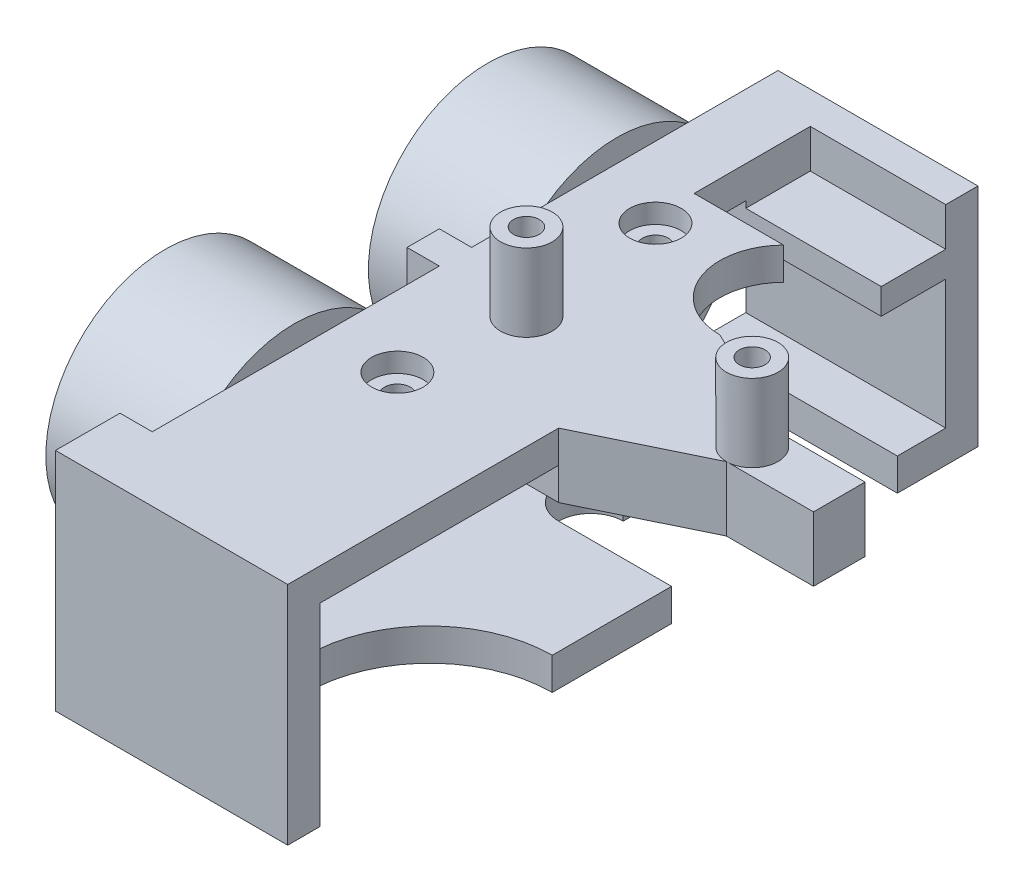
from build123d import *

# Parameters (mm, degrees)
SKETCH_1_W               = 62
SKETCH_1_H               = 90
SKETCH_1_R               = 5
SKETCH_1_R_2             = 10
EXTRUDE_1_DEPTH          = 7
SKETCH_3_R               = 10
SKETCH_3_R_2             = 5
EXTRUDE_2_DEPTH          = 7
SKETCH_4_R               = 18.5
EXTRUDE_3_DEPTH          = 20
SKETCH_5_W               = 42
SKETCH_5_H               = 18
CUT_EXTRUDE_1_DEPTH      = 7
SKETCH_7_R               = 2
EXTRUDE_5_DEPTH          = 5
SKETCH_6_R               = 4
SKETCH_6_R_2             = 2
EXTRUDE_7_DEPTH          = 12
SKETCH_18_R              = 4
CUT_EXTRUDE_8_DEPTH      = 3
CUT_EXTRUDE_3_DEPTH      = 73.124891681
CUT_EXTRUDE_3_DEPTH_BACK = 73.124891681
SKETCH_10_W              = 13.858571571
SKETCH_10_H              = 11.898979486
SKETCH_10_W_2            = 20
SKETCH_10_H_2            = 30
CUT_EXTRUDE_4_DEPTH      = 7
SKETCH_11_W              = 17.5
SKETCH_11_H              = 10
CUT_EXTRUDE_5_DEPTH      = 7
CUT_EXTRUDE_9_REACH      = 84.674
SKETCH_19_W              = 10.885621722
SKETCH_19_H              = 15
SKETCH_12_W              = 92.977348864
SKETCH_12_H              = 90
CUT_EXTRUDE_6_DEPTH      = 2
SKETCH_13_W              = 67.267412259
SKETCH_13_H              = 90
CUT_EXTRUDE_7_DEPTH      = 2
SKETCH_14_W              = 31
SKETCH_14_H              = 35
EXTRUDE_8_DEPTH          = 5
SKETCH_15_W              = 14.844505579
SKETCH_15_H              = 5
EXTRUDE_9_DEPTH          = 7
SKETCH_16_W              = 31
SKETCH_16_H              = 35
EXTRUDE_10_DEPTH         = 5
SKETCH_20_W              = 21
SKETCH_20_H              = 10
EXTRUDE_11_DEPTH         = 4
SKETCH_21_W              = 5
SKETCH_21_H              = 35
SKETCH_21_W_2            = 10
EXTRUDE_12_DEPTH         = 5
SKETCH_22_R              = 10
CUT_EXTRUDE_10_DEPTH     = 103.708324882
SKETCH_23_W              = 20
SKETCH_23_H              = 10
CUT_EXTRUDE_11_DEPTH     = 11


with BuildPart() as part:
    # 草图1 → 凸台-拉伸1 (new body)
    with BuildSketch(Plane(origin=(0, 0, 0), x_dir=(1, 0, 0), z_dir=(0, 1, 0))):
        Rectangle(SKETCH_1_W, SKETCH_1_H)
        with Locations(Location((-20, 20, 0), (0, 0, 270))):
            Circle(SKETCH_1_R, mode=Mode.SUBTRACT)
        with Locations(Location((20, 20, 0), (0, 0, 270))):
            Circle(SKETCH_1_R, mode=Mode.SUBTRACT)
        with Locations(Location((20, -20, 0), (0, 0, 270))):
            Circle(SKETCH_1_R, mode=Mode.SUBTRACT)
        with Locations(Location((-20, -20, 0), (0, 0, 270))):
            Circle(SKETCH_1_R, mode=Mode.SUBTRACT)
        with Locations(Location((0, 20, 0), (0, 0, 270))):
            Circle(SKETCH_1_R_2, mode=Mode.SUBTRACT)
    extrude(amount=EXTRUDE_1_DEPTH)



with BuildPart() as body_2:
    # 草图3 → 凸台-拉伸2 (new body)
    with BuildSketch(Plane(origin=(0, -16, 0), x_dir=(-1, 0, 0), z_dir=(0, -1, 0))):
        with BuildLine():
            Line((-31, 45), (31, 45))
            Line((31, 45), (31, -45))
            Line((31, -45), (16.155494421, -45))
            ThreePointArc((16.155494421, -45), (0, -16), (-16.155494421, -45))
            Line((-16.155494421, -45), (-31, -45))
            Line((-31, -45), (-31, 45))
        make_face()
        with Locations(Location((0, 20, 0), (0, 0, 270))):
            Circle(SKETCH_3_R, mode=Mode.SUBTRACT)
        with Locations(Location((17.5, 32.5, 0), (0, 0, 90))):
            Circle(SKETCH_3_R_2, mode=Mode.SUBTRACT)
        with Locations(Location((17.5, 7.5, 0), (0, 0, 90))):
            Circle(SKETCH_3_R_2, mode=Mode.SUBTRACT)
        with Locations(Location((-17.5, 7.5, 0), (0, 0, 90))):
            Circle(SKETCH_3_R_2, mode=Mode.SUBTRACT)
        with Locations(Location((-17.5, 32.5, 0), (0, 0, 90))):
            Circle(SKETCH_3_R_2, mode=Mode.SUBTRACT)
    extrude(amount=EXTRUDE_2_DEPTH)


with BuildPart() as part_1:
    add(part.part)

    add(body_2.part)  # 凸台-拉伸3 merges body 2
    # 草图4 → 凸台-拉伸3 (add)
    with BuildSketch(Plane(origin=(31, 0, 0), x_dir=(0, 0, -1), z_dir=(1, 0, 0))):
        with Locations(Location((-25, -3, 0), (0, 0, 170.667581816))):
            Circle(SKETCH_4_R)
        with Locations(Location((25, -3, 0), (0, 0, 170.667581816))):
            Circle(SKETCH_4_R)
    extrude_3 = extrude(amount=EXTRUDE_3_DEPTH)

    # 镜向1: 凸台-拉伸3 across plane
    add(extrude_3.mirror(Plane(origin=(0, 0, 0), x_dir=(0, 0, 1), z_dir=(1, 0, 0))))

    # 草图5 → 切除-拉伸1 (cut)
    with BuildSketch(Plane(origin=(0, 7, 0), x_dir=(1, 0, 0), z_dir=(0, 1, 0))):
        with Locations((0, 36)):
            Rectangle(SKETCH_5_W, SKETCH_5_H)
    extrude(amount=-CUT_EXTRUDE_1_DEPTH, mode=Mode.SUBTRACT)

    # 草图7 → 凸台-拉伸5 (add)
    with BuildSketch(Plane(origin=(0, 7, 0), x_dir=(1, 0, 0), z_dir=(0, 1, 0))):
        with BuildLine():
            Line((-7.141428429, 27), (-21, 27))
            Line((-21, 27), (-21, 45))
            Line((-21, 45), (-31, 45))
            Line((-31, 45), (-31, -45))
            Line((-31, -45), (31, -45))
            Line((31, -45), (31, 45))
            Line((31, 45), (21, 45))
            Line((21, 45), (21, 27))
            Line((21, 27), (7.141428429, 27))
            ThreePointArc((7.141428429, 27), (0, 10), (-7.141428429, 27))
        make_face()
        with Locations(Location((-20, 20, 0), (0, 0, 270))):
            Circle(SKETCH_7_R, mode=Mode.SUBTRACT)
        with Locations(Location((20, 20, 0), (0, 0, 270))):
            Circle(SKETCH_7_R, mode=Mode.SUBTRACT)
        with Locations(Location((20, -20, 0), (0, 0, 270))):
            Circle(SKETCH_7_R, mode=Mode.SUBTRACT)
        with Locations(Location((-20, -20, 0), (0, 0, 270))):
            Circle(SKETCH_7_R, mode=Mode.SUBTRACT)
    extrude(amount=EXTRUDE_5_DEPTH)

    # 草图6 → 凸台-拉伸7 (add)
    # profile 1 of 2: a face of its own
    with BuildSketch(Plane(origin=(0, 12, 0), x_dir=(1, 0, 0), z_dir=(0, 1, 0))):
        with Locations(Location((-17.5, -2.5, 0), (0, 0, 270))):
            Circle(SKETCH_6_R)
        with Locations(Location((-17.5, -2.5, 0), (0, 0, 270))):
            Circle(SKETCH_6_R_2, mode=Mode.SUBTRACT)
    # profile 2 of 2: a face of its own
    with BuildSketch(Plane(origin=(0, 12, 0), x_dir=(1, 0, 0), z_dir=(0, 1, 0))):
        with Locations(Location((17.5, -2.5, 0), (0, 0, 90))):
            Circle(SKETCH_6_R)
        with Locations(Location((17.5, -2.5, 0), (0, 0, 90))):
            Circle(SKETCH_6_R_2, mode=Mode.SUBTRACT)
    extrude(amount=EXTRUDE_7_DEPTH)

    # 草图18 → 切除-拉伸8 (cut)
    with BuildSketch(Plane(origin=(0, 12, 0), x_dir=(1, 0, 0), z_dir=(0, 1, 0))):
        with Locations(Location((-20, 20, 0), (0, 0, 270))):
            Circle(SKETCH_18_R)
        with Locations(Location((20, 20, 0), (0, 0, 270))):
            Circle(SKETCH_18_R)
        with Locations(Location((20, -20, 0), (0, 0, 270))):
            Circle(SKETCH_18_R)
        with Locations(Location((-20, -20, 0), (0, 0, 270))):
            Circle(SKETCH_18_R)
    extrude(amount=-CUT_EXTRUDE_8_DEPTH, mode=Mode.SUBTRACT)

    # 草图9 → 切除-拉伸3 (cut, two sides: drawn at the far end of the back side and taken through both)
    with BuildSketch(Plane(origin=(0, 0, 0), x_dir=(1, 0, 0), z_dir=(0, 1, 0)).offset(-CUT_EXTRUDE_3_DEPTH_BACK)):
        Polygon((58.168962293, 1.5), (58.168962293, 54.540507165), (0, 54.540507165), (0, 10), (17.5, 1.5), align=None)
        Polygon((0, -53.302122896), (58.168962293, -53.302122896), (58.168962293, -6.5), (17.5, -6.5), (0, -15), align=None)
    extrude(amount=CUT_EXTRUDE_3_DEPTH + CUT_EXTRUDE_3_DEPTH_BACK, mode=Mode.SUBTRACT)

    # 草图10 → 切除-拉伸4 (cut)
    with BuildSketch(Plane(origin=(0, 0, 0), x_dir=(1, 0, 0), z_dir=(0, 1, 0))):
        with Locations((-14.070714215, 21.050510257)):
            Rectangle(SKETCH_10_W, SKETCH_10_H)
        with Locations((-10, -30)):
            Rectangle(SKETCH_10_W_2, SKETCH_10_H_2)
    extrude(amount=CUT_EXTRUDE_4_DEPTH, mode=Mode.SUBTRACT)

    # 草图11 → 切除-拉伸5 (cut)
    with BuildSketch(Plane(origin=(0, -16, 0), x_dir=(1, 0, 0), z_dir=(0, 1, 0))):
        with Locations((-8.75, 32.5)):
            Rectangle(SKETCH_11_W, SKETCH_11_H)
        Polygon((-17.5, 12.5), (32.655458142, 12.5), (32.655458142, -18.188768946), (0, -18.188768946), (0, 2.5), (-17.5, 2.5), align=None)
    extrude(amount=-CUT_EXTRUDE_5_DEPTH, mode=Mode.SUBTRACT)

    # 草图19 → 切除-拉伸9 (cut, up to next)
    with BuildSketch(Plane.XZ.offset(23), mode=Mode.PRIVATE) as cut_extrude_9_sk1:
        with Locations((-12.057189139, -20)):
            Rectangle(SKETCH_19_W, SKETCH_19_H)
    cut_extrude_9_tool1 = extrude(cut_extrude_9_sk1.sketch, amount=-CUT_EXTRUDE_9_REACH, mode=Mode.PRIVATE) & part_1.part
    add(cut_extrude_9_tool1.solids().sort_by_distance((-12.057189, -23, -20))[0], mode=Mode.SUBTRACT)

    # 草图12 → 切除-拉伸6 (cut)
    with BuildSketch(Plane.XZ):
        with Locations((15.488674432, 0)):
            Rectangle(SKETCH_12_W, SKETCH_12_H)
    extrude(amount=-CUT_EXTRUDE_6_DEPTH, mode=Mode.SUBTRACT)

    # 草图13 → 切除-拉伸7 (cut)
    with BuildSketch(Plane(origin=(0, -16, 0), x_dir=(1, 0, 0), z_dir=(0, 1, 0))):
        with Locations((2.63370613, 0)):
            Rectangle(SKETCH_13_W, SKETCH_13_H)
    extrude(amount=-CUT_EXTRUDE_7_DEPTH, mode=Mode.SUBTRACT)

    # 草图14 → 凸台-拉伸8 (add)
    with BuildSketch(Plane(origin=(0, 0, -45), x_dir=(-1, 0, 0), z_dir=(0, 0, -1))):
        with Locations((15.5, -5.5)):
            Rectangle(SKETCH_14_W, SKETCH_14_H)
    extrude(amount=EXTRUDE_8_DEPTH)

    # 草图15 → 凸台-拉伸9 (add)
    with BuildSketch(Plane.XY.offset(45)):
        Polygon((0, 12), (0, 7), (-20, 7), (-20, 2), (-31, 2), (-31, 12), align=None)
        with Locations((-23.577747211, -20.5)):
            Rectangle(SKETCH_15_W, SKETCH_15_H)
    extrude(amount=EXTRUDE_9_DEPTH)

    # 草图16 → 凸台-拉伸10 (add)
    with BuildSketch(Plane.XY.offset(52)):
        with Locations((-15.5, -5.5)):
            Rectangle(SKETCH_16_W, SKETCH_16_H)
    extrude(amount=EXTRUDE_10_DEPTH)

    # 草图20 → 凸台-拉伸11 (add)
    with BuildSketch(Plane.XZ.offset(-2)):
        with Locations((-10.5, -40)):
            Rectangle(SKETCH_20_W, SKETCH_20_H)
    extrude(amount=-EXTRUDE_11_DEPTH)

    # 草图21 → 凸台-拉伸12 (add)
    with BuildSketch(Plane.ZY.offset(31)):
        with Locations((0, -5.5)):
            Rectangle(SKETCH_21_W, SKETCH_21_H)
        with Locations((52, -5.5)):
            Rectangle(SKETCH_21_W_2, SKETCH_21_H)
    extrude(amount=EXTRUDE_12_DEPTH)

    # 草图22 → 切除-拉伸10 (cut, through all)
    with BuildSketch(Plane.ZY.offset(51)):
        with Locations((-25, -3)):
            Circle(SKETCH_22_R)
        with Locations((25, -3)):
            Circle(SKETCH_22_R)
    extrude(amount=-CUT_EXTRUDE_10_DEPTH, mode=Mode.SUBTRACT)

    # 草图23 → 切除-拉伸11 (cut)
    with BuildSketch(Plane(origin=(-20, 0, 0), x_dir=(0, 0, -1), z_dir=(1, 0, 0))):
        with Locations((-25, 2)):
            Rectangle(SKETCH_23_W, SKETCH_23_H)
        Polygon((15, -3), (35, -3), (35, 7), (15.101020514, 7), align=None)
    extrude(amount=-CUT_EXTRUDE_11_DEPTH, mode=Mode.SUBTRACT)


solid = part_1.part
